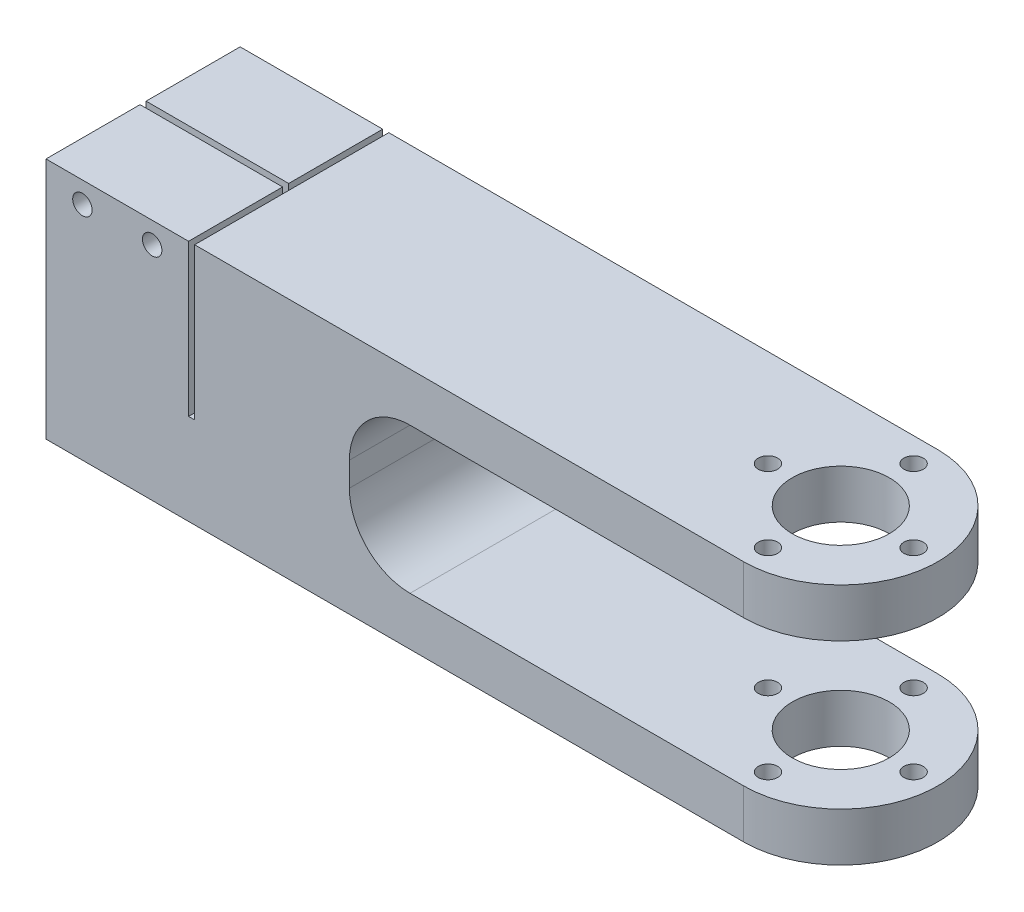
from build123d import *

# Parameters (mm, degrees)
EXTRUDE_1_DEPTH          = 20
CUT_EXTRUDE_1_REACH      = 87.195
SKETCH_2_R               = 8
SKETCH_4_R               = 12.5
CUT_EXTRUDE_2_DEPTH      = 40
CUT_EXTRUDE_3_REACH      = 84.621
SKETCH_5_W               = 81
SKETCH_5_H               = 24
CUT_EXTRUDE_4_REACH      = 87.195
CUT_EXTRUDE_4_END_RADIUS = 12.5
SKETCH_6_W               = 24
SKETCH_6_H               = 1
SKETCH_7_W               = 1
SKETCH_7_H               = 32
CUT_EXTRUDE_5_DEPTH      = 25
CUT_EXTRUDE_START        = -32
SKETCH_8_R               = 1.6
CUT_EXTRUDE_6_DEPTH      = 32
SKETCH_9_R               = 1.6
CUT_EXTRUDE_7_DEPTH      = 86.195363724
FILLET_1_R               = 10


with BuildPart() as part:
    # 草图1 → 凸台-拉伸1 (new, symmetric)
    with BuildSketch(Plane(origin=(0, 0, 0), x_dir=(1, 0, 0), z_dir=(0, 1, 0))):
        with BuildLine():
            Line((-57.5, 16), (57.5, 16))
            ThreePointArc((57.5, 16), (73.5, 0), (57.5, -16))
            Line((57.5, -16), (-57.5, -16))
            Line((-57.5, -16), (-57.5, 16))
        make_face()
    extrude(amount=EXTRUDE_1_DEPTH, both=True)

    # 草图2 → 切除-拉伸1 (cut, up to next)
    with BuildSketch(Plane(origin=(0, 20, 0), x_dir=(1, 0, 0), z_dir=(0, 1, 0)), mode=Mode.PRIVATE) as cut_extrude_1_sk1:
        with Locations(Location((57.5, 0, 0), (0, 0, 270))):
            Circle(SKETCH_2_R)
    cut_extrude_1_tool1 = extrude(cut_extrude_1_sk1.sketch, amount=-CUT_EXTRUDE_1_REACH, mode=Mode.PRIVATE) & part.part
    add(cut_extrude_1_tool1.solids().sort_by_distance((57.5, 20, 0))[0], mode=Mode.SUBTRACT)

    # 草图4 → 切除-拉伸2 (cut)
    with BuildSketch(Plane.ZY.offset(57.5)):
        Circle(SKETCH_4_R)
    extrude(amount=-CUT_EXTRUDE_2_DEPTH, mode=Mode.SUBTRACT)

    # 草图5 → 切除-拉伸3 (cut, up to next)
    with BuildSketch(Plane.XY.offset(16), mode=Mode.PRIVATE) as cut_extrude_3_sk1:
        with Locations((33, 0)):
            Rectangle(SKETCH_5_W, SKETCH_5_H)
    cut_extrude_3_tool1 = extrude(cut_extrude_3_sk1.sketch, amount=-CUT_EXTRUDE_3_REACH, mode=Mode.PRIVATE) & part.part
    add(cut_extrude_3_tool1.solids().sort_by_distance((33, 0, 16))[0], mode=Mode.SUBTRACT)

    # 切除-拉伸4: up to this cylinder (the profile starts outside it)
    cut_extrude_4_end = Plane(origin=(-45.5, 0, 0), z_dir=(-1, 0, 0)) * Cylinder(CUT_EXTRUDE_4_END_RADIUS, 200.39, mode=Mode.PRIVATE)
    # 草图6 → 切除-拉伸4 (cut, up to the surface)
    with BuildSketch(Plane(origin=(0, 20, 0), x_dir=(1, 0, 0), z_dir=(0, 1, 0)), mode=Mode.PRIVATE) as cut_extrude_4_sk1:
        with Locations((-45.5, 0)):
            Rectangle(SKETCH_6_W, SKETCH_6_H)
    cut_extrude_4_tool1 = extrude(cut_extrude_4_sk1.sketch, amount=-CUT_EXTRUDE_4_REACH, mode=Mode.PRIVATE) - cut_extrude_4_end
    add(cut_extrude_4_tool1.solids().sort_by_distance((-45.5, 20, 0))[0], mode=Mode.SUBTRACT)

    # 草图7 → 切除-拉伸5 (cut)
    with BuildSketch(Plane(origin=(0, 20, 0), x_dir=(1, 0, 0), z_dir=(0, 1, 0))):
        with Locations((-33.5, 0)):
            Rectangle(SKETCH_7_W, SKETCH_7_H)
    extrude(amount=-CUT_EXTRUDE_5_DEPTH, mode=Mode.SUBTRACT)

    # 草图8 → 切除-拉伸6 (cut)
    with BuildSketch(Plane.XY.offset(16).offset(CUT_EXTRUDE_START)):
        with Locations((-51.5, 16.5)):
            Circle(SKETCH_8_R)
        with Locations((-40, 16.5)):
            Circle(SKETCH_8_R)
    extrude(amount=CUT_EXTRUDE_6_DEPTH, mode=Mode.SUBTRACT)

    # 草图9 → 切除-拉伸7 (cut, through all)
    with BuildSketch(Plane(origin=(0, 20, 0), x_dir=(1, 0, 0), z_dir=(0, 1, 0))):
        with Locations(Location((69.5, 0, 0), (0, 0, 270))):
            Circle(SKETCH_9_R)
        with Locations(Location((45.5, 0, 0), (0, 0, 270))):
            Circle(SKETCH_9_R)
        with Locations(Location((57.5, 12, 0), (0, 0, 270))):
            Circle(SKETCH_9_R)
        with Locations(Location((57.5, -12, 0), (0, 0, 270))):
            Circle(SKETCH_9_R)
    extrude(amount=-CUT_EXTRUDE_7_DEPTH, mode=Mode.SUBTRACT)

    # 圆角1
    fillet_1_edges = [part.edges().sort_by_distance(p)[0] for p in [
        (-7.5, -12, 0),
        (-7.5, 12, 0),
    ]]
    fillet(fillet_1_edges, radius=FILLET_1_R)


solid = part.part
